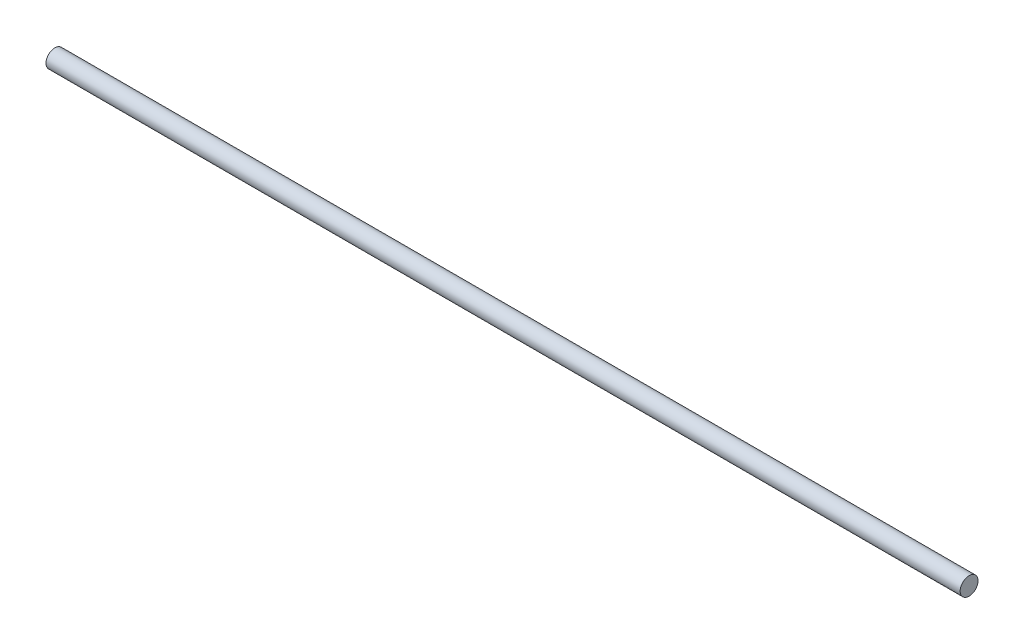
from build123d import *

# Parameters (mm, degrees)
SKETCH3_R           = 4
BOSS_EXTRUDE1_DEPTH = 410


with BuildPart() as part:
    # Sketch3 → Boss-Extrude1 (new body)
    with BuildSketch(Plane(origin=(0, 0, 0), x_dir=(0, 0, -1), z_dir=(1, 0, 0))):
        with Locations(Location((0, 0, 0), (0, 0, 180))):
            Circle(SKETCH3_R)
    extrude(amount=BOSS_EXTRUDE1_DEPTH)


solid = part.part
